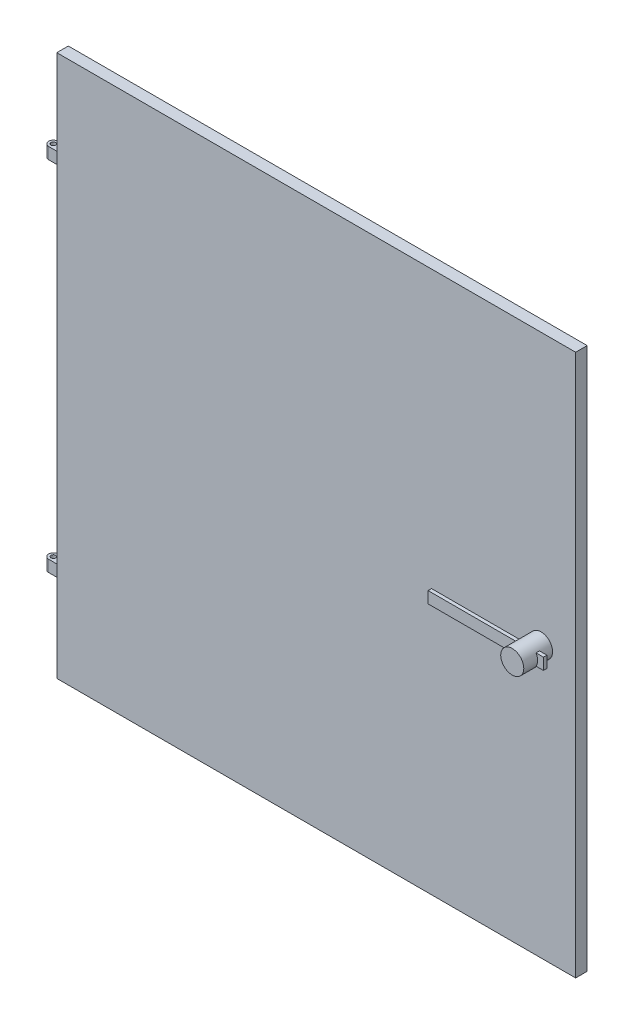
from build123d import *

# Parameters (mm, degrees)
SKETCH1_W           = 450
SKETCH1_H           = 470
BASE_EXTRUDE_DEPTH  = 10
SHELL1_T            = -2
SKETCH2_R           = 2
BOSS_EXTRUDE1_DEPTH = 10
SKETCH3_R           = 10
BOSS_EXTRUDE2_DEPTH = 25
SKETCH4_W           = 100
SKETCH4_H           = 10
BOSS_EXTRUDE3_DEPTH = 3


with BuildPart() as part:
    # Sketch1 → Base-Extrude (new body)
    with BuildSketch(Plane.XY):
        with Locations((225, 235)):
            Rectangle(SKETCH1_W, SKETCH1_H)
    extrude(amount=BASE_EXTRUDE_DEPTH)

    # Shell1
    shell1_openings = [part.faces().sort_by_distance(p)[0] for p in [
        (225, 235, 0),
    ]]
    offset(amount=SHELL1_T, openings=shell1_openings, kind=Kind.INTERSECTION)

    # Sketch2 → Boss-Extrude1 (add)
    with BuildSketch(Plane(origin=(0, 395, 0), x_dir=(-1, 0, 0), z_dir=(0, 1, 0))):
        with BuildLine():
            Line((8, 9), (0, 9))
            Line((0, 9), (0, 1))
            Line((0, 1), (8, 1))
            ThreePointArc((8, 1), (12, 5), (8, 9))
        make_face()
        with Locations(Location((8, 5, 0), (0, 0, 90))):
            Circle(SKETCH2_R, mode=Mode.SUBTRACT)
    boss_extrude1 = extrude(amount=-BOSS_EXTRUDE1_DEPTH)

    # Mirror1: Boss-Extrude1 across plane
    add(boss_extrude1.mirror(Plane.ZX.offset(235)))

    # Sketch3 → Boss-Extrude2 (add)
    with BuildSketch(Plane.XY.offset(10)):
        with Locations(Location((420, 235, 0), (0, 0, 180))):
            Circle(SKETCH3_R)
    extrude(amount=BOSS_EXTRUDE2_DEPTH)

    # Sketch4 → Boss-Extrude3 (add)
    with BuildSketch(Plane.XY.offset(20)):
        with Locations((385, 235)):
            Rectangle(SKETCH4_W, SKETCH4_H)
    extrude(amount=BOSS_EXTRUDE3_DEPTH)


solid = part.part
